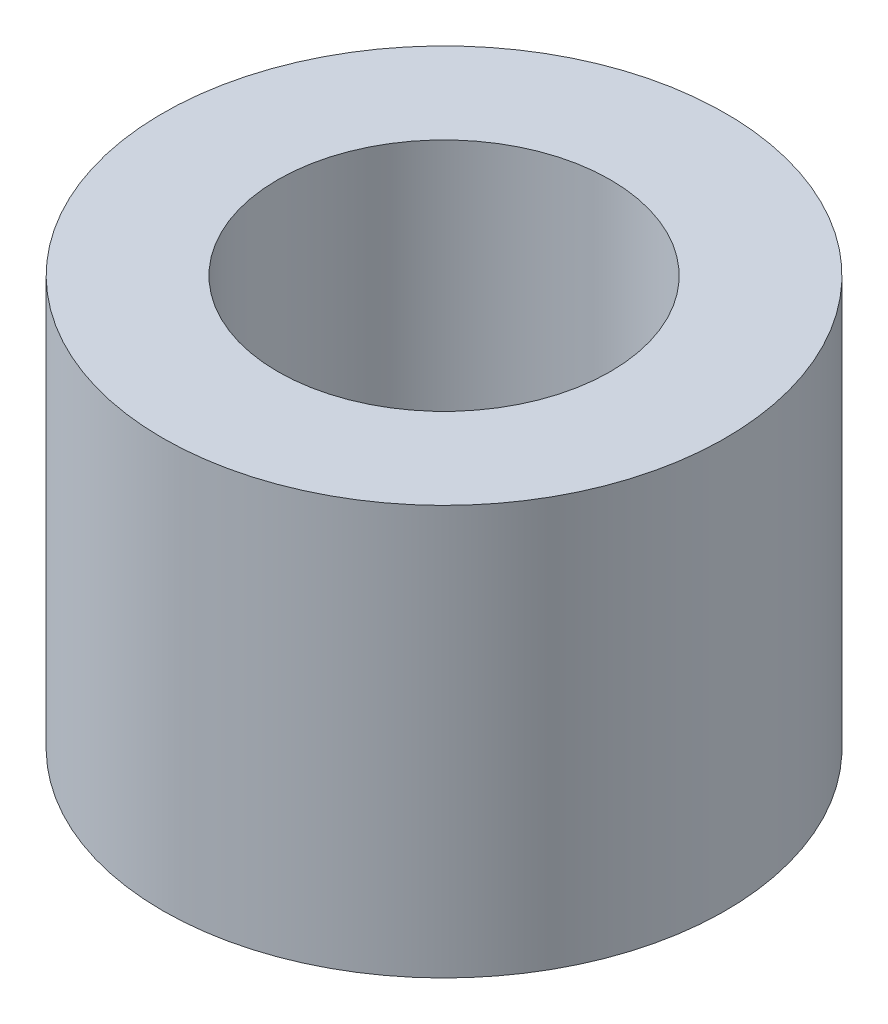
from build123d import *

# Parameters (mm, degrees)
SKETCH1_R           = 2.75
SKETCH1_R_2         = 1.625
BOSS_EXTRUDE1_DEPTH = 4


with BuildPart() as part:
    # Sketch1 → Boss-Extrude1 (new body)
    with BuildSketch(Plane(origin=(0, 0, 0), x_dir=(1, 0, 0), z_dir=(0, 1, 0))):
        with Locations(Location((0, 0, 0), (0, 0, 270))):
            Circle(SKETCH1_R)
        with Locations(Location((0, 0, 0), (0, 0, 270))):
            Circle(SKETCH1_R_2, mode=Mode.SUBTRACT)
    extrude(amount=BOSS_EXTRUDE1_DEPTH)


solid = part.part
